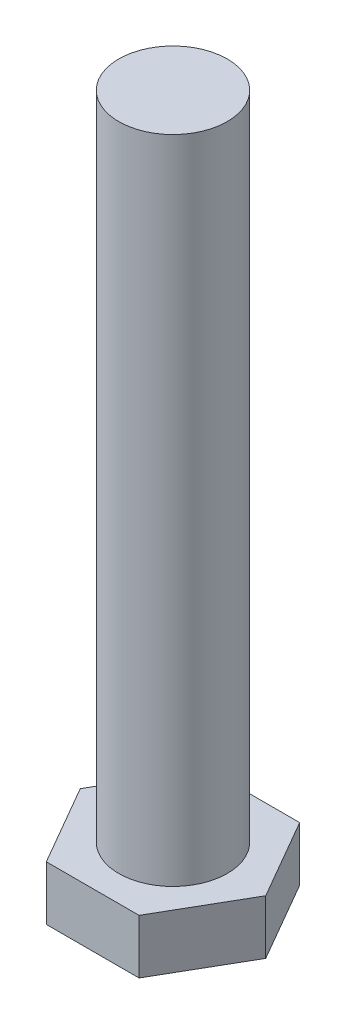
from build123d import *

# Parameters (mm, degrees)
BOSS_EXTRUDE1_DEPTH = 6.35
SKETCH2_R           = 6.35
BOSS_EXTRUDE2_DEPTH = 76.2


with BuildPart() as part:
    # Sketch1 → Boss-Extrude1 (new body)
    with BuildSketch(Plane(origin=(0, 0, 0), x_dir=(1, 0, 0), z_dir=(0, 1, 0))):
        Polygon((5.42593783, -9.398), (10.85187566, 0), (5.42593783, 9.398), (-5.42593783, 9.398), (-10.85187566, 0), (-5.42593783, -9.398), align=None)
    extrude(amount=BOSS_EXTRUDE1_DEPTH)

    # Sketch2 → Boss-Extrude2 (add)
    with BuildSketch(Plane(origin=(0, 6.35, 0), x_dir=(1, 0, 0), z_dir=(0, 1, 0))):
        with Locations(Location((0, 0, 0), (0, 0, 90))):
            Circle(SKETCH2_R)
    extrude(amount=BOSS_EXTRUDE2_DEPTH)


solid = part.part
